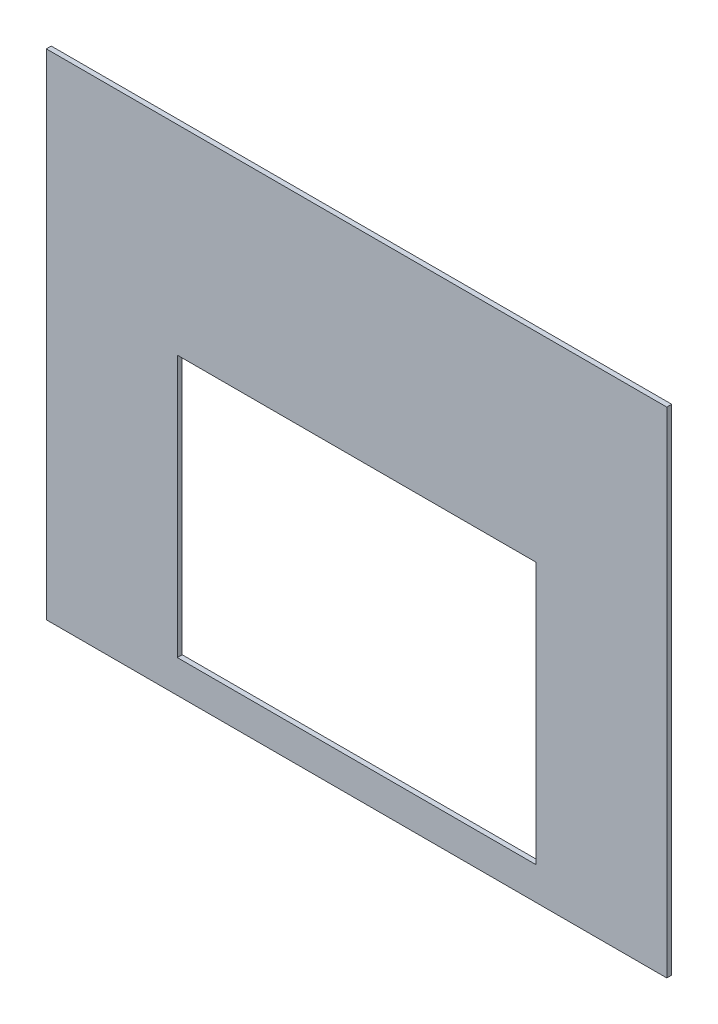
from build123d import *

# Parameters (mm, degrees)
SKETCH1_W           = 379
SKETCH1_H           = 302
SKETCH1_W_2         = 219
SKETCH1_H_2         = 160
BOSS_EXTRUDE1_DEPTH = 3


with BuildPart() as part:
    # Sketch1 → Boss-Extrude1 (new body)
    with BuildSketch(Plane.XY):
        Rectangle(SKETCH1_W, SKETCH1_H)
        with Locations((0, -51)):
            Rectangle(SKETCH1_W_2, SKETCH1_H_2, mode=Mode.SUBTRACT)
    extrude(amount=BOSS_EXTRUDE1_DEPTH)


solid = part.part
